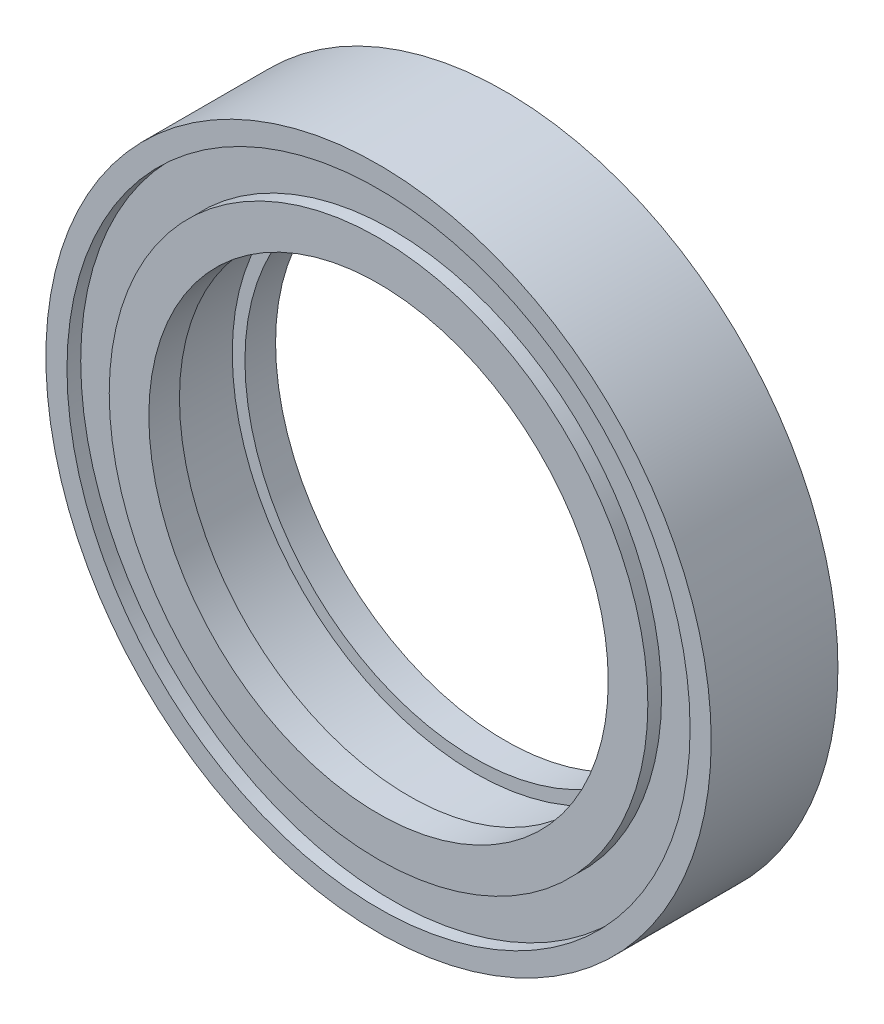
from build123d import *


with BuildPart() as part:
    # Sketch1 → Revolve1 (revolve)
    with BuildSketch(Plane(origin=(0, 0, 0), x_dir=(1, 0, 0), z_dir=(0, 1, 0)), mode=Mode.PRIVATE) as revolve1_sk:
        Polygon((-315, 60), (-295, 60), (-295, 47), (-255, 47), (-255, 60), (-217.5, 60), (-217.5, 31), (-229.5, 31), (-229.5, -31), (-217.5, -31), (-217.5, -60), (-255, -60), (-255, -47), (-295, -47), (-295, -60), (-315, -60), align=None)
    revolve(revolve1_sk.sketch.rotate(Axis((0, 0, 1000), (0, 0, -1)), 180), axis=Axis((0, 0, 1000), (0, 0, -1)))


solid = part.part
